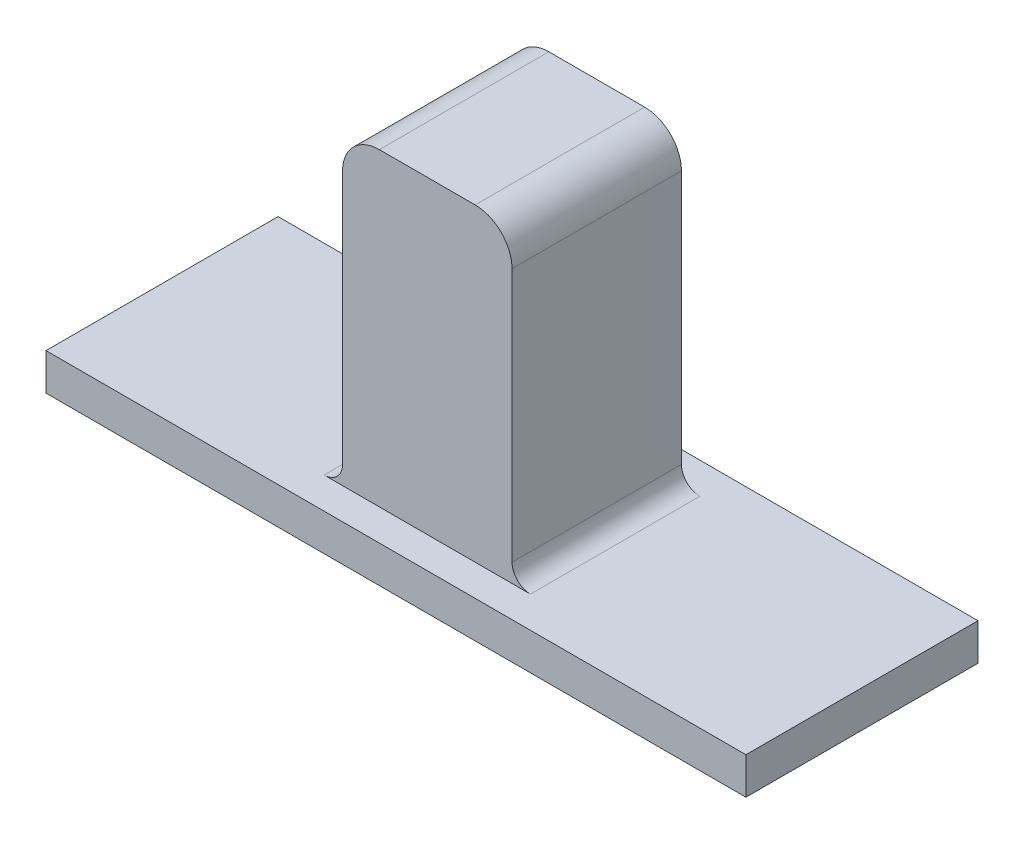
from build123d import *

# Parameters (mm, degrees)
SKETCH1_W           = 19
SKETCH1_H           = 6.3
BOSS_EXTRUDE1_DEPTH = 1
SKETCH1_3_W         = 4.6
SKETCH1_3_H         = 4.6
BOSS_EXTRUDE2_DEPTH = 9.4
FILLET6_R           = 1
FILLET7_R           = 1
FILLET9_R           = 0.5
FILLET10_R          = 0.5
CUT_EXTRUDE6_DEPTH  = 3


with BuildPart() as part:
    # Sketch1 → Boss-Extrude1 (new body)
    with BuildSketch(Plane(origin=(0, 0, 0), x_dir=(1, 0, 0), z_dir=(0, 1, 0))):
        with Locations((2.580402043, 0.806197617)):
            Rectangle(SKETCH1_W, SKETCH1_H)
    extrude(amount=BOSS_EXTRUDE1_DEPTH)

    # Sketch1<3> → Boss-Extrude2 (add)
    with BuildSketch(Plane(origin=(0, 0, 0), x_dir=(1, 0, 0), z_dir=(0, 1, 0))):
        with Locations((2.580402043, 0.806197617)):
            Rectangle(SKETCH1_3_W, SKETCH1_3_H)
    extrude(amount=BOSS_EXTRUDE2_DEPTH)

    # Fillet6
    fillet6_edges = [part.edges().sort_by_distance(p)[0] for p in [
        (4.880402043, 9.4, -0.806197617),
    ]]
    fillet(fillet6_edges, radius=FILLET6_R)

    # Fillet7
    fillet7_edges = [part.edges().sort_by_distance(p)[0] for p in [
        (0.280402043, 9.4, -0.806197617),
    ]]
    fillet(fillet7_edges, radius=FILLET7_R)

    # Fillet9
    fillet9_edges = [part.edges().sort_by_distance(p)[0] for p in [
        (4.880402043, 1, -0.806197617),
    ]]
    fillet(fillet9_edges, radius=FILLET9_R)

    # Fillet10
    fillet10_edges = [part.edges().sort_by_distance(p)[0] for p in [
        (0.280402043, 1, -0.806197617),
    ]]
    fillet(fillet10_edges, radius=FILLET10_R)

    # Sketch1<6> → Cut-Extrude6 (cut)
    with BuildSketch(Plane(origin=(0, 0, 0), x_dir=(1, 0, 0), z_dir=(0, 1, 0))):
        Polygon((1.730402043, 1.656197617), (1.730402043, 1.096346732), (1.830402043, 1.096346732), (1.830402043, 0.525612743), (1.730402043, 0.525612743), (1.730402043, -0.043802383), (2.321489292, -0.043802383), (2.321489292, 0.056197617), (2.868074208, 0.056197617), (2.868074208, -0.043802383), (3.430402043, -0.043802383), (3.430402043, 0.525612743), (3.330402043, 0.525612743), (3.330402043, 1.096346732), (3.430402043, 1.096346732), (3.430402043, 1.656197617), (2.868074208, 1.656197617), (2.868074208, 1.556197617), (2.282451593, 1.556197617), (2.282451593, 1.656197617), align=None)
    extrude(amount=CUT_EXTRUDE6_DEPTH, mode=Mode.SUBTRACT)


solid = part.part
